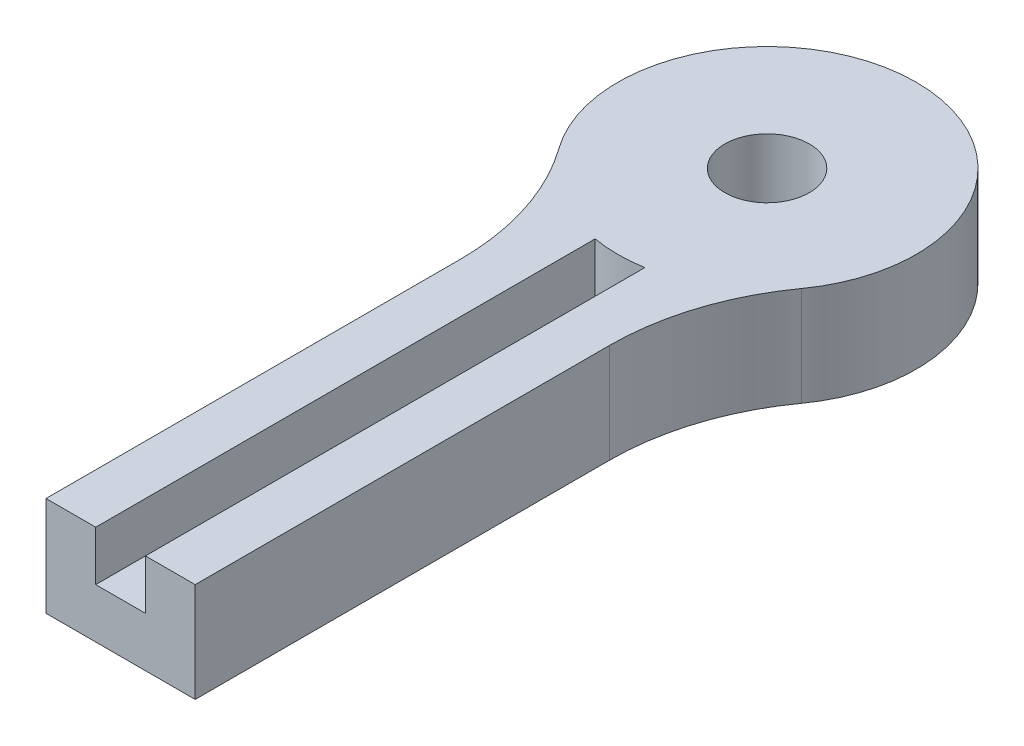
from build123d import *

# Parameters (mm, degrees)
SKETCH1_R           = 6
SKETCH1_R_2         = 1.7
BOSS_EXTRUDE1_DEPTH = 2
SKETCH2_W           = 2
SKETCH2_H           = 20.803847577
BOSS_EXTRUDE2_DEPTH = 2
SKETCH3_R           = 6
SKETCH3_R_2         = 1.7
BOSS_EXTRUDE3_DEPTH = 2
FILLET1_R           = 10


with BuildPart() as part:
    # Sketch1 → Boss-Extrude1 (new body)
    # profile 1 of 3: a face of its own
    with BuildSketch(Plane(origin=(0, 0, 0), x_dir=(1, 0, 0), z_dir=(0, 1, 0))):
        Circle(SKETCH1_R)
        with Locations(Location((0, 0, 0), (0, 0, 270))):
            Circle(SKETCH1_R_2, mode=Mode.SUBTRACT)
    # profile 2 of 3: a face of its own
    with BuildSketch(Plane(origin=(0, 0, 0), x_dir=(1, 0, 0), z_dir=(0, 1, 0))):
        with BuildLine():
            ThreePointArc((3, -5.196152423), (1.552914271, -5.795554958), (0, -6))
            Line((0, -6), (0, -26))
            Line((0, -26), (3, -26))
            Line((3, -26), (3, -5.196152423))
        make_face()
    # profile 3 of 3: a face of its own
    with BuildSketch(Plane(origin=(0, 0, 0), x_dir=(1, 0, 0), z_dir=(0, 1, 0))):
        with BuildLine():
            Line((0, -26), (0, -6))
            ThreePointArc((0, -6), (-1.552914271, -5.795554958), (-3, -5.196152423))
            Line((-3, -5.196152423), (-3, -26))
            Line((-3, -26), (0, -26))
        make_face()
    extrude(amount=BOSS_EXTRUDE1_DEPTH)

    # Sketch2 → Boss-Extrude2 (add)
    with BuildSketch(Plane(origin=(0, 2, 0), x_dir=(1, 0, 0), z_dir=(0, 1, 0))):
        with Locations((-2, -15.598076212)):
            Rectangle(SKETCH2_W, SKETCH2_H)
        with Locations((2, -15.598076212)):
            Rectangle(SKETCH2_W, SKETCH2_H)
    extrude(amount=BOSS_EXTRUDE2_DEPTH)

    # Sketch3 → Boss-Extrude3 (add)
    with BuildSketch(Plane(origin=(0, 2, 0), x_dir=(1, 0, 0), z_dir=(0, 1, 0))):
        Circle(SKETCH3_R)
        with Locations(Location((0, 0, 0), (0, 0, 270))):
            Circle(SKETCH3_R_2, mode=Mode.SUBTRACT)
    extrude(amount=BOSS_EXTRUDE3_DEPTH)

    # Fillet1
    fillet1_edges = [part.edges().sort_by_distance(p)[0] for p in [
        (-3, 2, 5.196152423),
        (3, 2, 5.196152423),
    ]]
    fillet(fillet1_edges, radius=FILLET1_R)


solid = part.part
